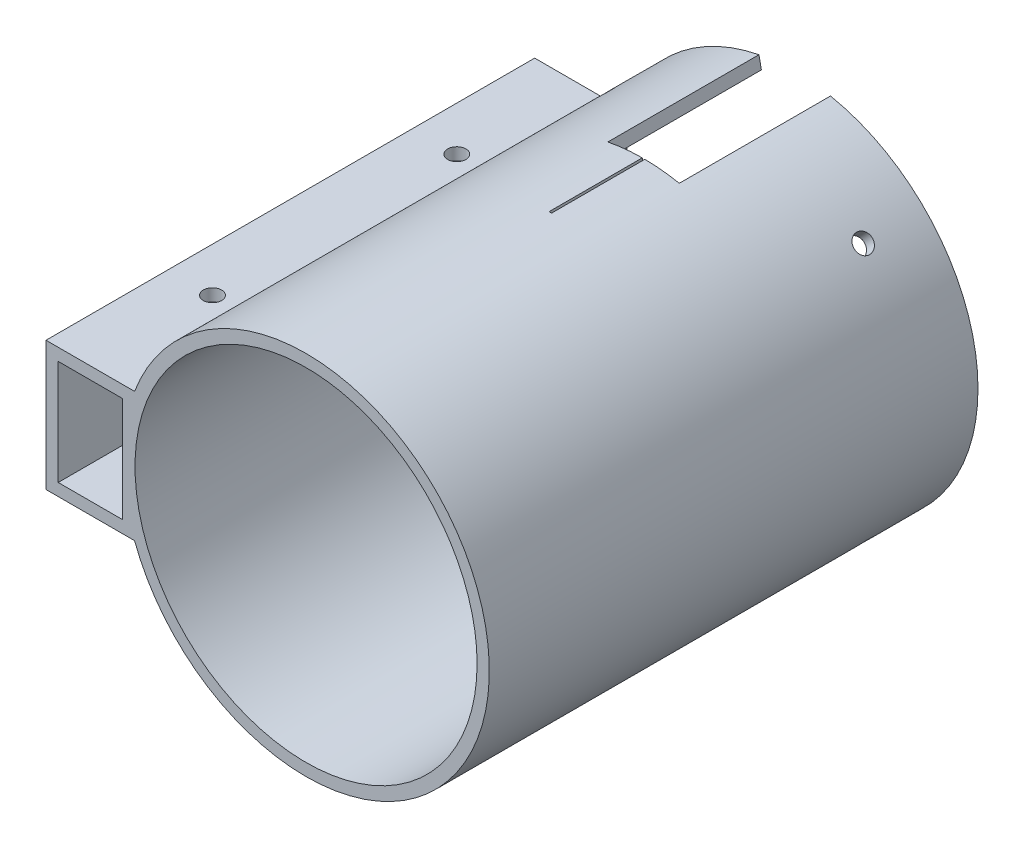
from build123d import *

# Parameters (mm, degrees)
SKETCH1_R               = 33.6
SKETCH1_W               = 12.6
SKETCH1_H               = 20.6
BOSS_EXTRUDE1_DEPTH     = 96
CUT_EXTRUDE1_DEPTH      = 115.550093395
CUT_EXTRUDE1_DEPTH_BACK = 115.550093395
SKETCH2_W               = 48
SKETCH2_H               = 0.5
BOSS_EXTRUDE2_REACH     = 130.771
SKETCH3_R               = 3
SKETCH4_R               = 3
CUT_EXTRUDE2_DEPTH      = 10.2
SKETCH5_R               = 1.8
CUT_EXTRUDE3_DEPTH      = 136.732562696
CIRPATTERN1_COUNT       = 4
SKETCH12_R              = 1.8
CUT_EXTRUDE7_DEPTH      = 120.152901457
CUT_EXTRUDE8_DEPTH      = 115.55009351
CUT_EXTRUDE8_DEPTH_BACK = 115.55009351
SKETCH13_W              = 12
SKETCH13_H              = 29.4
CUT_EXTRUDE10_DEPTH     = 29.7


with BuildPart() as part:
    # Sketch1 → Boss-Extrude1 (new body)
    with BuildSketch(Plane.XY):
        with BuildLine():
            Line((-51.085456803, 12.7), (-33.685456803, 12.7))
            ThreePointArc((-33.685456803, 12.7), (36, 0), (-33.685456803, -12.7))
            Line((-33.685456803, -12.7), (-51.085456803, -12.7))
            Line((-51.085456803, -12.7), (-51.085456803, 12.7))
        make_face()
        Circle(SKETCH1_R, mode=Mode.SUBTRACT)
        with Locations((-42.385456803, 0)):
            Rectangle(SKETCH1_W, SKETCH1_H, mode=Mode.SUBTRACT)
    extrude(amount=BOSS_EXTRUDE1_DEPTH)

    # Sketch2 → Cut-Extrude1 (cut, two sides: drawn at the far end of the back side and taken through both)
    with BuildSketch(Plane(origin=(0, 0, 0), x_dir=(0, 0, -1), z_dir=(0, 1, 0)).offset(-CUT_EXTRUDE1_DEPTH_BACK)):
        with Locations((-24, 0)):
            Rectangle(SKETCH2_W, SKETCH2_H)
    extrude(amount=CUT_EXTRUDE1_DEPTH + CUT_EXTRUDE1_DEPTH_BACK, mode=Mode.SUBTRACT)

    # Sketch3 → Boss-Extrude2 (add, up to next)
    with BuildSketch(Plane(origin=(16.674534964, 16.674534964, 0), x_dir=(0, 0, -1), z_dir=(0.7071067811865488, 0.7071067811865464, 0)), mode=Mode.PRIVATE) as boss_extrude2_sk1:
        with Locations((-12, 0)):
            Circle(SKETCH3_R)
    boss_extrude2_tool1 = extrude(boss_extrude2_sk1.sketch, amount=BOSS_EXTRUDE2_REACH, mode=Mode.PRIVATE) - part.part
    boss_extrude2 = boss_extrude2_tool1.solids().sort_by_distance((16.674535, 16.674535, 12))[0]
    add(boss_extrude2)

    # Sketch4 → Cut-Extrude2 (cut)
    with BuildSketch(Plane(origin=(16.674534964, 16.674534964, 0), x_dir=(0, 0, 1), z_dir=(-0.7071067811865487, -0.7071067811865465, 0))):
        with Locations((12, 0)):
            Circle(SKETCH4_R)
    cut_extrude2 = extrude(amount=-CUT_EXTRUDE2_DEPTH, mode=Mode.SUBTRACT)

    # Sketch5 → Cut-Extrude3 (cut, through all)
    with BuildSketch(Plane(origin=(23.887024132, 23.887024132, 0), x_dir=(0, 0, 1), z_dir=(-0.7071067811865486, -0.7071067811865465, 0))):
        with Locations((12, 0)):
            Circle(SKETCH5_R)
    cut_extrude3 = extrude(amount=-CUT_EXTRUDE3_DEPTH, mode=Mode.SUBTRACT)

    # CirPattern1: Boss-Extrude2, Cut-Extrude2, Cut-Extrude3 ×4 about axis
    cirpattern1_axis = Axis((0, 0, 96), (0, 0, -1))
    add([boss_extrude2.rotate(cirpattern1_axis, i * 360 / CIRPATTERN1_COUNT) for i in range(1, CIRPATTERN1_COUNT)])
    add([cut_extrude2.rotate(cirpattern1_axis, i * 360 / CIRPATTERN1_COUNT) for i in range(1, CIRPATTERN1_COUNT)], mode=Mode.SUBTRACT)
    add([cut_extrude3.rotate(cirpattern1_axis, i * 360 / CIRPATTERN1_COUNT) for i in range(1, CIRPATTERN1_COUNT)], mode=Mode.SUBTRACT)

    # Sketch12 → Cut-Extrude7 (cut, through all)
    with BuildSketch(Plane(origin=(0, 12.7, 0), x_dir=(1, 0, 0), z_dir=(0, 1, 0))):
        with Locations((-42.385456803, -24)):
            Circle(SKETCH12_R)
        with Locations((-42.385456803, -72)):
            Circle(SKETCH12_R)
    extrude(amount=-CUT_EXTRUDE7_DEPTH, mode=Mode.SUBTRACT)

    # Sketch13 → Cut-Extrude8 (cut, two sides: drawn at the far end of the back side and taken through both)
    with BuildSketch(Plane(origin=(0, 0, 0), x_dir=(1, 0, 0), z_dir=(0, 1, 0)).offset(-CUT_EXTRUDE8_DEPTH_BACK)):
        with Locations((0, -14.7)):
            Rectangle(SKETCH13_W, SKETCH13_H)
    extrude(amount=CUT_EXTRUDE8_DEPTH + CUT_EXTRUDE8_DEPTH_BACK, mode=Mode.SUBTRACT)

    # Sketch15 → Cut-Extrude10 (cut)
    with BuildSketch(Plane(origin=(0, 0, 0), x_dir=(-1, 0, 0), z_dir=(0, 0, -1))):
        with BuildLine():
            Line((-7.023251593, -35.308270095), (-6.55503482, -32.954385422))
            ThreePointArc((-6.55503482, -32.954385422), (0, -33.6), (6.55503482, -32.954385422))
            Line((6.55503482, -32.954385422), (7.023251593, -35.308270095))
            ThreePointArc((7.023251593, -35.308270095), (0, -36), (-7.023251593, -35.308270095))
        make_face()
        with BuildLine():
            Line((7.023251593, 35.308270095), (6.55503482, 32.954385422))
            ThreePointArc((6.55503482, 32.954385422), (0, 33.6), (-6.55503482, 32.954385422))
            Line((-6.55503482, 32.954385422), (-7.023251593, 35.308270095))
            ThreePointArc((-7.023251593, 35.308270095), (0, 36), (7.023251593, 35.308270095))
        make_face()
    extrude(amount=-CUT_EXTRUDE10_DEPTH, mode=Mode.SUBTRACT)


solid = part.part
